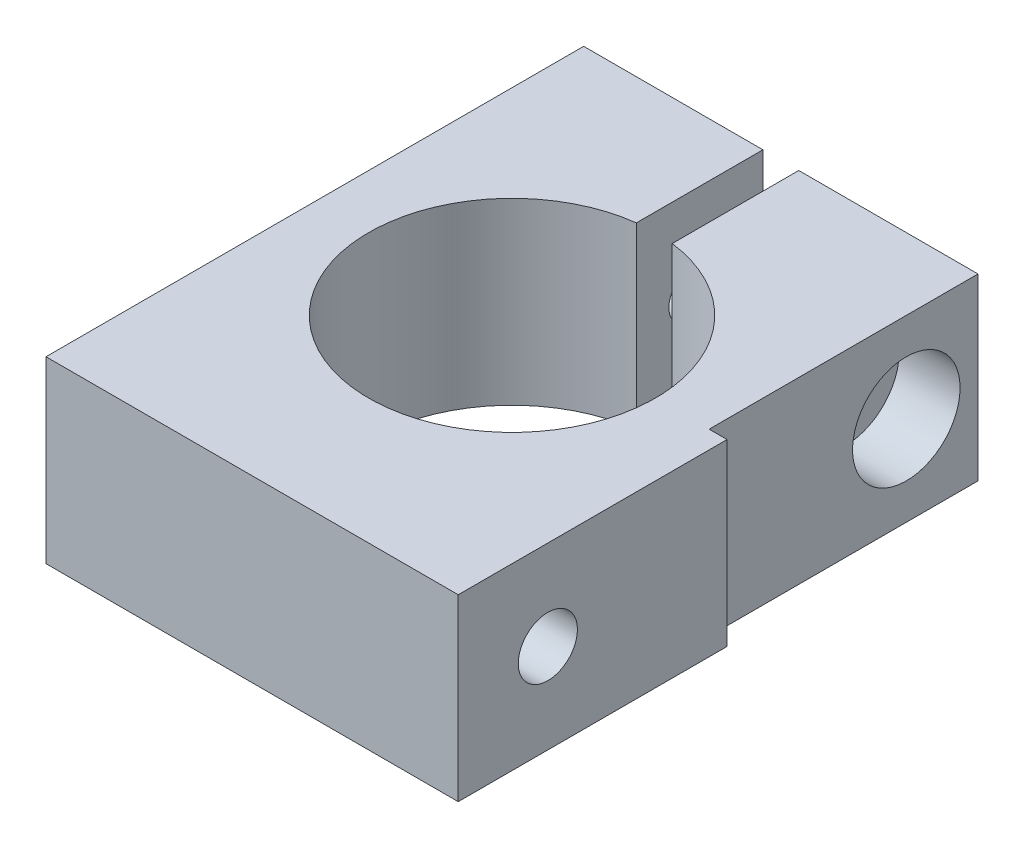
from build123d import *

# Parameters (mm, degrees)
EXTRUDE_1_DEPTH           = 5
HOLE_WIZARD_1_D           = 3.2
HOLE_WIZARD_1_DEPTH       = 10
HOLE_WIZARD_1_CBORE_D     = 6
HOLE_WIZARD_1_CBORE_DEPTH = 3.4
HOLE_WIZARD_M3_1_D        = 2.5
SKETCH_9_W                = 15
SKETCH_9_H                = 10
EXTRUDE_2_DEPTH           = 1
HOLE_WIZARD_M4_1_D        = 3.3
HOLE_WIZARD_M4_1_DEPTH    = 9.5
HOLE_WIZARD_M4_1_TIP      = 0.991420021


with BuildPart() as part:
    # 草图1 → 凸台-拉伸1 (new, symmetric)
    with BuildSketch(Plane(origin=(0, 0, 0), x_dir=(1, 0, 0), z_dir=(0, 1, 0))):
        with BuildLine():
            Line((11, -15), (-11, -15))
            Line((-11, -15), (-11, 15))
            Line((-11, 15), (-1, 15))
            Line((-1, 15), (-1, 7.937253933))
            ThreePointArc((-1, 7.937253933), (0, -8), (1, 7.937253933))
            Line((1, 7.937253933), (1, 15))
            Line((1, 15), (11, 15))
            Line((11, 15), (11, -15))
        make_face()
    extrude(amount=EXTRUDE_1_DEPTH, both=True)

    # 打孔尺寸(%根据)内六角圆柱头螺钉的类型1
    with Locations(Plane(origin=(11, 0, 0), x_dir=(0, 0, -1), z_dir=(1, 0, 0))):
        with Locations((11, 0)):
            CounterBoreHole(HOLE_WIZARD_1_D / 2, HOLE_WIZARD_1_CBORE_D / 2, HOLE_WIZARD_1_CBORE_DEPTH, depth=HOLE_WIZARD_1_DEPTH)

    # M3 螺纹孔1 (through all)
    with Locations(Plane.ZY.offset(11)):
        with Locations((-11, 0)):
            Hole(HOLE_WIZARD_M3_1_D / 2)

    # 草图9 → 凸台-拉伸2 (add)
    with BuildSketch(Plane(origin=(11, 0, 0), x_dir=(0, 0, -1), z_dir=(1, 0, 0))):
        with Locations((-7.5, 0)):
            Rectangle(SKETCH_9_W, SKETCH_9_H)
    extrude(amount=EXTRUDE_2_DEPTH)

    # M4 螺纹孔1
    with Locations(Plane(origin=(12, 0, 7), x_dir=(0, 0, 1), z_dir=(1, 0, 0))):
        with Locations((3, 0)):
            Hole(HOLE_WIZARD_M4_1_D / 2, depth=HOLE_WIZARD_M4_1_DEPTH)
            with Locations((0, 0, -(HOLE_WIZARD_M4_1_DEPTH + HOLE_WIZARD_M4_1_TIP / 2))):  # 118° drill point
                Cone(0, HOLE_WIZARD_M4_1_D / 2, HOLE_WIZARD_M4_1_TIP, mode=Mode.SUBTRACT)


solid = part.part
